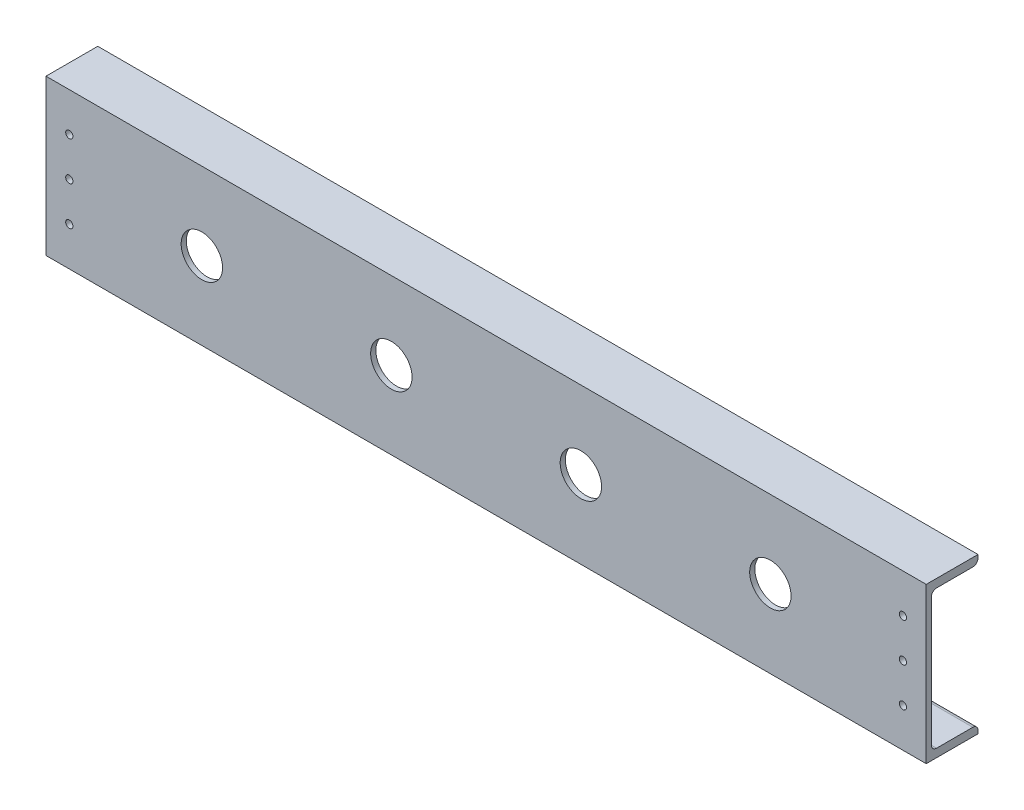
from build123d import *

# Parameters (mm, degrees)
BOSS_EXTRUDE1_DEPTH = 1700
SKETCH3_R           = 7
CUT_EXTRUDE1_DEPTH  = 10
SKETCH5_R           = 40
CUT_EXTRUDE3_DEPTH  = 30
LPATTERN2_COUNT     = 4
LPATTERN2_PITCH     = 366


with BuildPart() as part:
    # Sketch1 → Boss-Extrude1 (new body)
    with BuildSketch(Plane(origin=(0, 0, 0), x_dir=(0, 0, -1), z_dir=(1, 0, 0))):
        with BuildLine():
            Line((-86.622073579, 113.879598662), (-186.622073579, 113.879598662))
            Line((-186.622073579, 113.879598662), (-186.622073579, -186.120401338))
            Line((-186.622073579, -186.120401338), (-86.622073579, -186.120401338))
            Line((-86.622073579, -186.120401338), (-86.622073579, -180.120401338))
            ThreePointArc((-86.622073579, -180.120401338), (-89.551005767, -173.049333526), (-96.622073579, -170.120401338))
            Line((-96.622073579, -170.120401338), (-166.622073579, -170.120401338))
            ThreePointArc((-166.622073579, -170.120401338), (-173.69314139, -167.19146915), (-176.622073579, -160.120401338))
            Line((-176.622073579, -160.120401338), (-176.622073579, 87.879598662))
            ThreePointArc((-176.622073579, 87.879598662), (-173.69314139, 94.950666474), (-166.622073579, 97.879598662))
            Line((-166.622073579, 97.879598662), (-96.622073579, 97.879598662))
            ThreePointArc((-96.622073579, 97.879598662), (-89.551005767, 100.80853085), (-86.622073579, 107.879598662))
            Line((-86.622073579, 107.879598662), (-86.622073579, 113.879598662))
        make_face()
    extrude(amount=BOSS_EXTRUDE1_DEPTH)

    # Sketch3 → Cut-Extrude1 (cut)
    with BuildSketch(Plane.XY.offset(186.622073579)):
        with Locations((1655, 38.879598662)):
            Circle(SKETCH3_R)
        with Locations((1655, -36.120401338)):
            Circle(SKETCH3_R)
        with Locations((1655, -111.120401338)):
            Circle(SKETCH3_R)
    cut_extrude1 = extrude(amount=-CUT_EXTRUDE1_DEPTH, mode=Mode.SUBTRACT)

    # Mirror1: Cut-Extrude1 across plane
    add(cut_extrude1.mirror(Plane(origin=(850, 0, 0), x_dir=(0, 0, 1), z_dir=(1, 0, 0))), mode=Mode.SUBTRACT)

    # Sketch5 → Cut-Extrude3 (cut)
    with BuildSketch(Plane(origin=(0, 0, 176.622073579), x_dir=(-1, 0, 0), z_dir=(0, 0, -1))):
        with Locations(Location((-1399, -36.120401338, 0), (0, 0, 90))):
            Circle(SKETCH5_R)
    cut_extrude3 = extrude(amount=-CUT_EXTRUDE3_DEPTH, mode=Mode.SUBTRACT)

    # LPattern2: Cut-Extrude3 ×4
    with Locations(*[(-i * LPATTERN2_PITCH, 0, 0) for i in range(1, LPATTERN2_COUNT)]):
        add(cut_extrude3, mode=Mode.SUBTRACT)


solid = part.part
